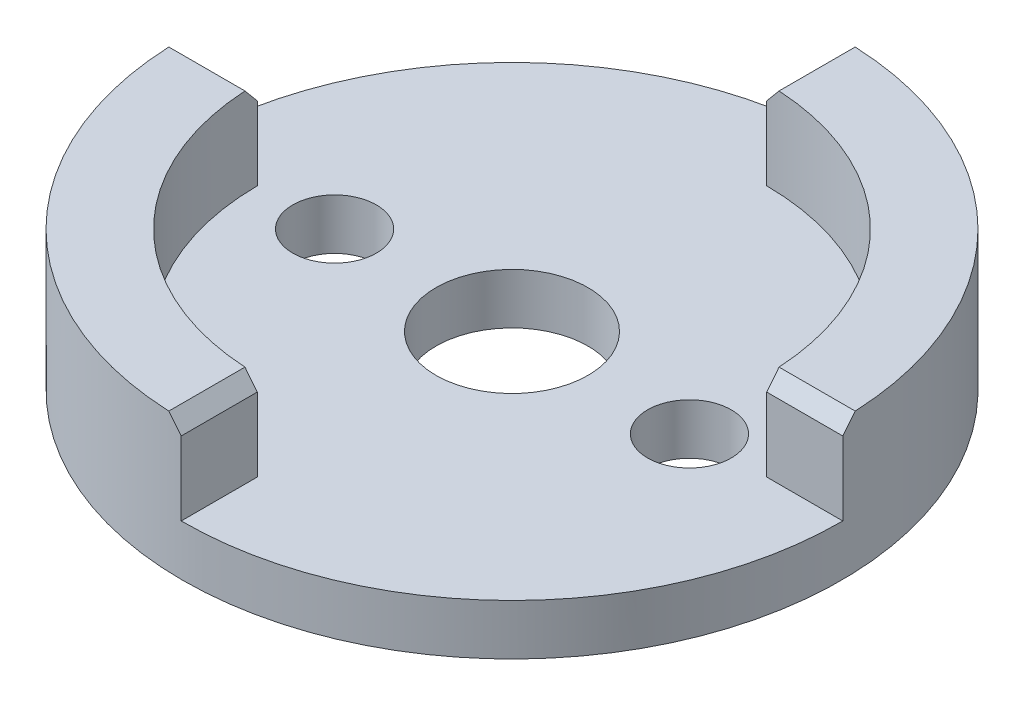
from build123d import *
from OCP.BRepFilletAPI import BRepFilletAPI_MakeChamfer

# Parameters (mm, degrees)
SKETCH_1_R      = 13
SKETCH_1_R_2    = 1.65
SKETCH_1_R_3    = 3
EXTRUDE_1_DEPTH = 2
EXTRUDE_2_DEPTH = 3.5
CHAMFER_1_SIZE  = 0.5
CHAMFER_1_SIZE2 = 0.595876796


with BuildPart() as part:
    # 草图1 → 凸台-拉伸1 (new body)
    with BuildSketch(Plane(origin=(0, 0, 0), x_dir=(1, 0, 0), z_dir=(0, 1, 0))):
        with Locations(Location((0, 0, 0), (0, 0, 270))):
            Circle(SKETCH_1_R)
        with Locations(Location((7, 0, 0), (0, 0, 270))):
            Circle(SKETCH_1_R_2, mode=Mode.SUBTRACT)
        with Locations(Location((-7, 0, 0), (0, 0, 270))):
            Circle(SKETCH_1_R_2, mode=Mode.SUBTRACT)
        with Locations(Location((0, 0, 0), (0, 0, 270))):
            Circle(SKETCH_1_R_3, mode=Mode.SUBTRACT)
    extrude(amount=EXTRUDE_1_DEPTH)

    # 草图2 → 凸台-拉伸2 (add)
    with BuildSketch(Plane(origin=(0, 2, 0), x_dir=(1, 0, 0), z_dir=(0, 1, 0))):
        with BuildLine():
            ThreePointArc((12.999903846, 0.05), (9.192388155, 9.192388155), (0.05, 12.999903846))
            Line((0.05, 12.999903846), (0.05, 9.999874999))
            ThreePointArc((0.05, 9.999874999), (7.071067812, 7.071067812), (9.999874999, 0.05))
            Line((9.999874999, 0.05), (12.999903846, 0.05))
        make_face()
        with BuildLine():
            Line((-9.999874999, -0.05), (-12.999903846, -0.05))
            ThreePointArc((-12.999903846, -0.05), (-9.192388155, -9.192388155), (-0.05, -12.999903846))
            Line((-0.05, -12.999903846), (-0.05, -9.999874999))
            ThreePointArc((-0.05, -9.999874999), (-7.071067812, -7.071067812), (-9.999874999, -0.05))
        make_face()
    extrude(amount=EXTRUDE_2_DEPTH)

    # 倒角1: one chamfer whose edges measure the first distance from different faces: ONE call of the kernel's chamfer builder (chamfer() names one face for all edges)
    chamfer_1_edges_1 = [part.edges().sort_by_distance(p)[0] for p in [
        (11.499889423, 5.5, -0.05),
        (0.05, 5.5, -11.499889423),
    ]]
    chamfer_1_side_1 = [part.faces().sort_by_distance(p)[0] for p in [
        (7.371553631, 5.5, -7.371553631),
    ]]
    chamfer_1_edges_2 = [part.edges().sort_by_distance(p)[0] for p in [
        (-11.499889423, 5.5, 0.05),
        (-0.05, 5.5, 11.499889423),
    ]]
    chamfer_1_side_2 = [part.faces().sort_by_distance(p)[0] for p in [
        (-7.371553631, 5.5, 7.371553631),
    ]]
    chamfer_1 = BRepFilletAPI_MakeChamfer(part.part.solid().wrapped)
    for e in chamfer_1_edges_1:
        chamfer_1.Add(CHAMFER_1_SIZE, CHAMFER_1_SIZE2, e.wrapped, chamfer_1_side_1[0].wrapped)  # the first distance lies on this face
    for e in chamfer_1_edges_2:
        chamfer_1.Add(CHAMFER_1_SIZE, CHAMFER_1_SIZE2, e.wrapped, chamfer_1_side_2[0].wrapped)  # the first distance lies on this face
    add(Compound.cast(chamfer_1.Shape()), mode=Mode.REPLACE)


solid = part.part
